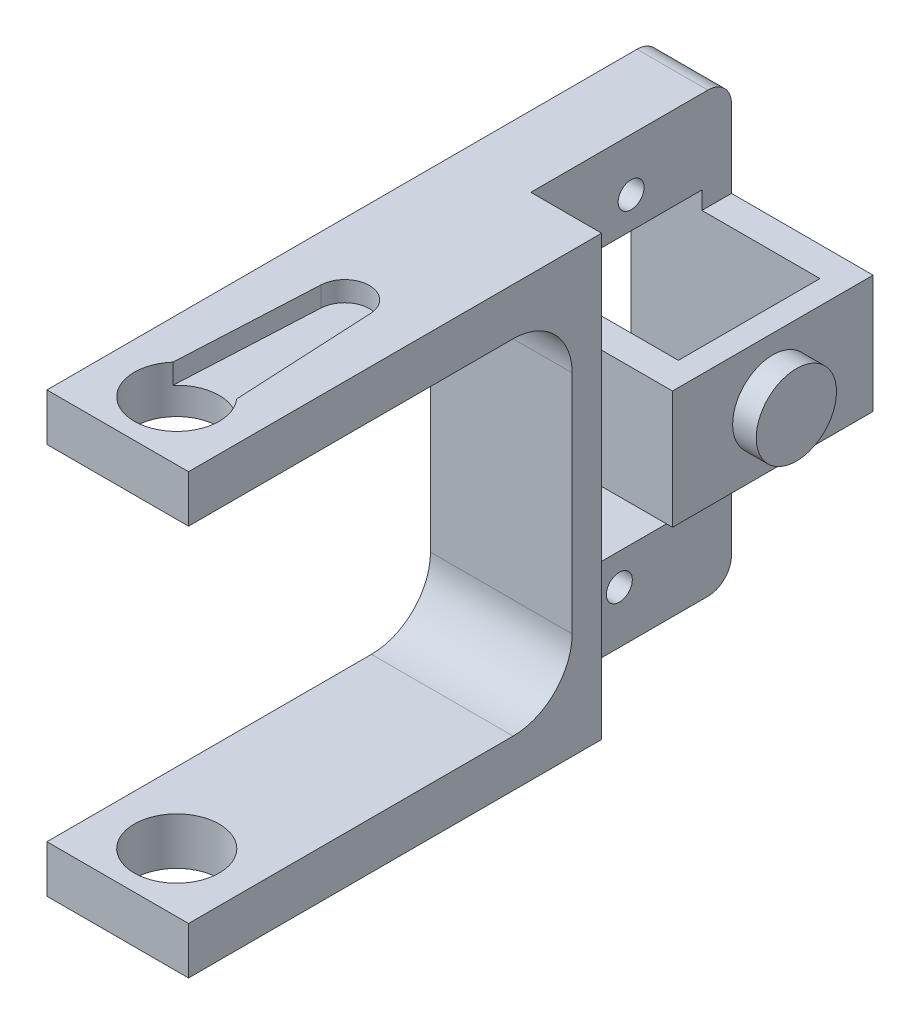
from build123d import *
from build123d.topology import SkipClean

# Parameters (mm, degrees)
SKETCH2_W             = 12
SKETCH2_H             = 4
BOSS_EXTRUDE2_DEPTH   = 35
BOSS_EXTRUDE2_2_DEPTH = 35
SKETCH2_3_W           = 12
SKETCH2_3_H           = 29.15
BOSS_EXTRUDE3_DEPTH   = 2.5
SKETCH7_W             = 6
SKETCH7_H             = 37.15
BOSS_EXTRUDE4_DEPTH   = 17
CUT_EXTRUDE5_REACH    = 51.94
SKETCH8_R             = 1.1
SKETCH8_W             = 12
SKETCH8_H             = 23
CUT_EXTRUDE6_DEPTH    = 1.7
SKETCH10_R            = 3.6
CUT_EXTRUDE7_DEPTH    = 52.773465505
FILLET6_R             = 5
FILLET7_R             = 5
SKETCH12_W            = 2.5
SKETCH12_H            = 10
BOSS_EXTRUDE5_DEPTH   = 10
SKETCH13_W            = 17
SKETCH13_H            = 10
BOSS_EXTRUDE6_DEPTH   = 2
SKETCH14_R            = 3.4
BOSS_EXTRUDE7_DEPTH   = 2
FILLET8_R             = 2
FILLET9_R             = 2


with BuildPart() as part:
    # Sketch2 → Boss-Extrude2 (new body)
    with BuildSketch(Plane.XY):
        with Locations((-2.681545395, 0.036493048)):
            Rectangle(SKETCH2_W, SKETCH2_H)
    extrude(amount=BOSS_EXTRUDE2_DEPTH)

    # Sketch2<3> → Boss-Extrude3 (add)
    with BuildSketch(Plane.XY):
        with Locations((-2.681545395, -16.538506952)):
            Rectangle(SKETCH2_3_W, SKETCH2_3_H)
    extrude(amount=BOSS_EXTRUDE3_DEPTH)



with BuildPart() as body_2:
    # Sketch2 → Boss-Extrude2 2 (new body)
    with BuildSketch(Plane.XY):
        with Locations((-2.681545395, -33.113506952)):
            Rectangle(SKETCH2_W, SKETCH2_H)
    extrude(amount=BOSS_EXTRUDE2_2_DEPTH)


with BuildPart() as part_1:
    add(part.part)

    add(body_2.part)  # Boss-Extrude4 merges body 2
    # Sketch7 → Boss-Extrude4 (add)
    with BuildSketch(Plane(origin=(0, 0, 0), x_dir=(-1, 0, 0), z_dir=(0, 0, -1))):
        with Locations((5.681545395, -16.538506952)):
            Rectangle(SKETCH7_W, SKETCH7_H)
    extrude(amount=BOSS_EXTRUDE4_DEPTH)

    # Sketch8 → Cut-Extrude5 (cut, up to next)
    with BuildSketch(Plane(origin=(-2.681545395, 0, 0), x_dir=(0, 0, -1), z_dir=(1, 0, 0)), mode=Mode.PRIVATE) as cut_extrude5_sk1:
        with Locations((8.5, -2.388506952)):
            Circle(SKETCH8_R)
    cut_extrude5_tool1 = extrude(cut_extrude5_sk1.sketch, amount=-CUT_EXTRUDE5_REACH, mode=Mode.PRIVATE) & part_1.part
    # Sketch8 → Cut-Extrude5 (cut, up to next)
    with BuildSketch(Plane(origin=(-2.681545395, 0, 0), x_dir=(0, 0, -1), z_dir=(1, 0, 0)), mode=Mode.PRIVATE) as cut_extrude5_sk2:
        with Locations((7.5, -30.688506952)):
            Circle(SKETCH8_R)
    cut_extrude5_tool2 = extrude(cut_extrude5_sk2.sketch, amount=-CUT_EXTRUDE5_REACH, mode=Mode.PRIVATE) & part_1.part
    # Sketch8 → Cut-Extrude5 (cut, up to next)
    with BuildSketch(Plane(origin=(-2.681545395, 0, 0), x_dir=(0, 0, -1), z_dir=(1, 0, 0)), mode=Mode.PRIVATE) as cut_extrude5_sk3:
        with Locations((8.5, -16.538506952)):
            Rectangle(SKETCH8_W, SKETCH8_H)
    cut_extrude5_tool3 = extrude(cut_extrude5_sk3.sketch, amount=-CUT_EXTRUDE5_REACH, mode=Mode.PRIVATE) & part_1.part
    add(cut_extrude5_tool1.solids().sort_by_distance((-2.681545, -2.388507, -8.5))[0], mode=Mode.SUBTRACT)
    add(cut_extrude5_tool2.solids().sort_by_distance((-2.681545, -30.688507, -7.5))[0], mode=Mode.SUBTRACT)
    add(cut_extrude5_tool3.solids().sort_by_distance((-2.681545, -16.538507, -8.5))[0], mode=Mode.SUBTRACT)

    # Sketch9 → Cut-Extrude6 (cut)
    with BuildSketch(Plane(origin=(0, 2.036493048, 0), x_dir=(1, 0, 0), z_dir=(0, 1, 0))):
        with BuildLine():
            Line((-0.584210872, -15.668774056), (0.018454605, -27.61882382))
            ThreePointArc((0.018454605, -27.61882382), (-2.681545395, -33.6), (-5.381545395, -27.61882382))
            Line((-5.381545395, -27.61882382), (-4.778879917, -15.668774056))
            ThreePointArc((-4.778879917, -15.668774056), (-2.681545395, -13.674546931), (-0.584210872, -15.668774056))
        make_face()
    extrude(amount=-CUT_EXTRUDE6_DEPTH, mode=Mode.SUBTRACT)

    # Sketch10 → Cut-Extrude7 (cut, through all)
    with BuildSketch(Plane(origin=(0, 2.036493048, 0), x_dir=(1, 0, 0), z_dir=(0, 1, 0))):
        with Locations((-2.681545395, -30)):
            Circle(SKETCH10_R)
    extrude(amount=-CUT_EXTRUDE7_DEPTH, mode=Mode.SUBTRACT)

    # Fillet6
    fillet6_edges = [part_1.edges().sort_by_distance(p)[0] for p in [
        (-2.681545395, -1.963506952, 2.5),
    ]]
    fillet(fillet6_edges, radius=FILLET6_R)

    # Fillet7
    fillet7_edges = [part_1.edges().sort_by_distance(p)[0] for p in [
        (-2.681545395, -31.113506952, 2.5),
    ]]
    fillet(fillet7_edges, radius=FILLET7_R)

    # Sketch12 → Boss-Extrude5 (add)
    with SkipClean():  # the faces are left unmerged after this step: merging them gives an invalid solid
        with BuildSketch(Plane(origin=(-2.681545395, 0, 0), x_dir=(0, 0, -1), z_dir=(1, 0, 0))):
            with Locations((1.25, -11.543506952)):
                Rectangle(SKETCH12_W, SKETCH12_H)
            with Locations((15.75, -11.543506952)):
                Rectangle(SKETCH12_W, SKETCH12_H)
        extrude(amount=BOSS_EXTRUDE5_DEPTH)

    # Sketch13 → Boss-Extrude6 (add)
    with SkipClean():  # the faces are left unmerged after this step: merging them gives an invalid solid
        with BuildSketch(Plane(origin=(7.318454605, 0, 0), x_dir=(0, 0, -1), z_dir=(1, 0, 0))):
            with Locations((8.5, -11.543506952)):
                Rectangle(SKETCH13_W, SKETCH13_H)
        extrude(amount=BOSS_EXTRUDE6_DEPTH)

    # Sketch14 → Boss-Extrude7 (add)
    with SkipClean():  # the faces are left unmerged after this step: merging them gives an invalid solid
        with BuildSketch(Plane(origin=(9.318454605, 0, 0), x_dir=(0, 0, -1), z_dir=(1, 0, 0))):
            with Locations((8.5, -11.543506952)):
                Circle(SKETCH14_R)
        extrude(amount=BOSS_EXTRUDE7_DEPTH)

    # Fillet8
    fillet8_edges = [part_1.edges().sort_by_distance(p)[0] for p in [
        (-5.681545395, 2.036493048, -17),
    ]]
    fillet(fillet8_edges, radius=FILLET8_R)

    # Fillet9
    fillet9_edges = [part_1.edges().sort_by_distance(p)[0] for p in [
        (-5.681545395, -35.113506952, -17),
    ]]
    fillet(fillet9_edges, radius=FILLET9_R)


solid = part_1.part
